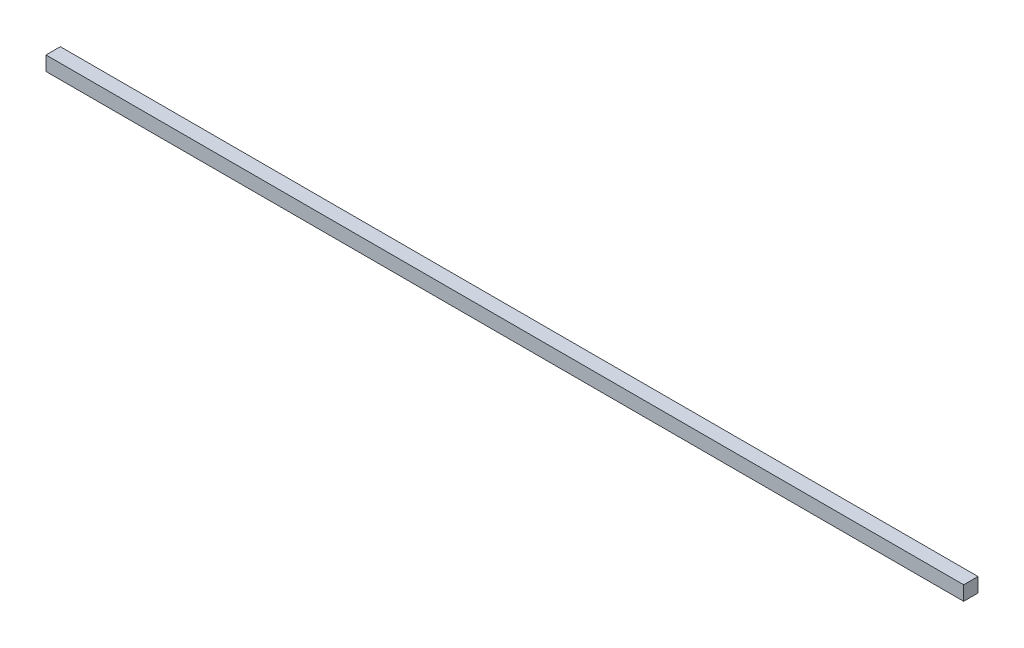
from build123d import *

# Parameters (mm, degrees)
SKETCH1_W           = 2438.4
SKETCH1_H           = 38.1
BOSS_EXTRUDE1_DEPTH = 38.1


with BuildPart() as part:
    # Sketch1 → Boss-Extrude1 (new body)
    with BuildSketch(Plane.XY):
        Rectangle(SKETCH1_W, SKETCH1_H)
    extrude(amount=BOSS_EXTRUDE1_DEPTH)


solid = part.part
